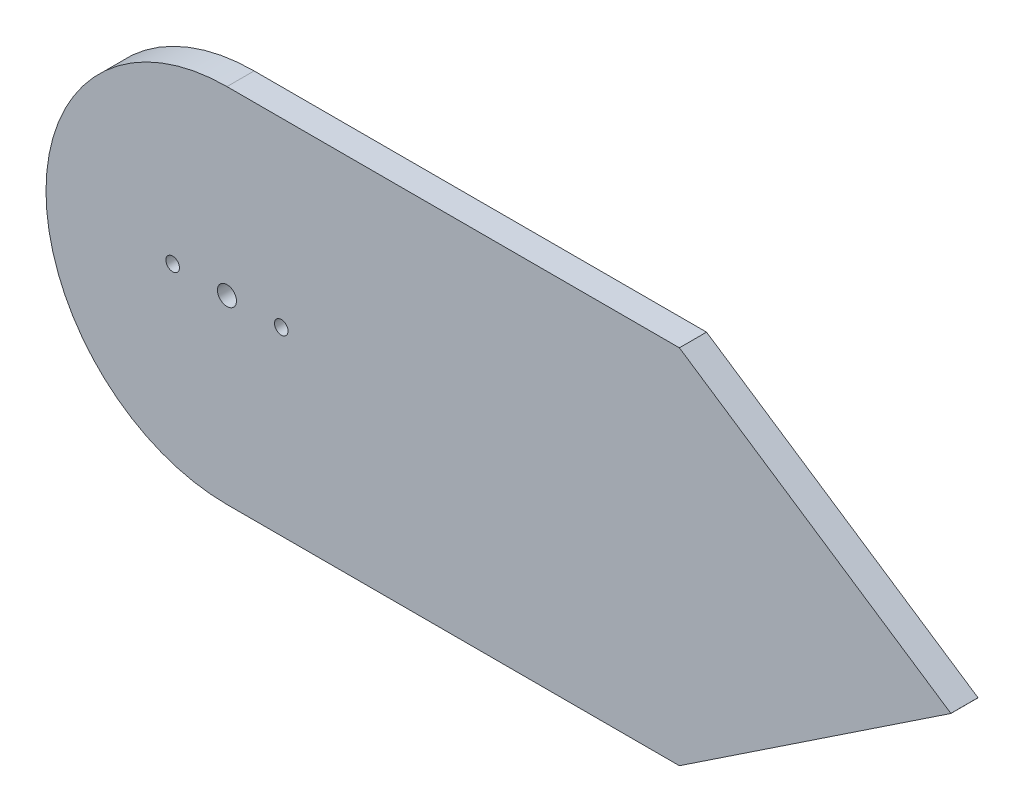
from build123d import *

# Parameters (mm, degrees)
BOSS_EXTRUDE1_DEPTH   = 3
BODY_MOVE_COPY1_ANGLE = 90
CUT_EXTRUDE2_REACH    = 84.517
SKETCH8_R             = 1.05
SKETCH8_R_2           = 0.75


with BuildPart() as part:
    # Sketch1 → Boss-Extrude1 (new body)
    with BuildSketch(Plane(origin=(0, 0, 0), x_dir=(1, 0, 0), z_dir=(0, 1, 0))):
        with BuildLine():
            Line((50, -20), (0, -20))
            ThreePointArc((0, -20), (-20, 0), (0, 20))
            Line((0, 20), (50, 20))
            Line((50, 20), (80, 0.010830805))
            Line((80, 0.010830805), (80, 0))
            Line((80, 0), (50, -20))
        make_face()
    extrude(amount=BOSS_EXTRUDE1_DEPTH)


with BuildPart() as part_1:
    # Body-Move/Copy1: moved
    add(part.part.rotate(Axis((0, 0, 0), (1, 0, 0)), BODY_MOVE_COPY1_ANGLE))

    # Sketch8 → Cut-Extrude2 (cut, up to next)
    with BuildSketch(Plane.XY.offset(3), mode=Mode.PRIVATE) as cut_extrude2_sk1:
        Circle(SKETCH8_R)
    cut_extrude2_tool1 = extrude(cut_extrude2_sk1.sketch, amount=-CUT_EXTRUDE2_REACH, mode=Mode.PRIVATE) & part_1.part
    # Sketch8 → Cut-Extrude2 (cut, up to next)
    with BuildSketch(Plane.XY.offset(3), mode=Mode.PRIVATE) as cut_extrude2_sk2:
        with Locations((6, -0.032589943)):
            Circle(SKETCH8_R_2)
    cut_extrude2_tool2 = extrude(cut_extrude2_sk2.sketch, amount=-CUT_EXTRUDE2_REACH, mode=Mode.PRIVATE) & part_1.part
    # Sketch8 → Cut-Extrude2 (cut, up to next)
    with BuildSketch(Plane.XY.offset(3), mode=Mode.PRIVATE) as cut_extrude2_sk3:
        with Locations((-5.999934973, 0.027934237)):
            Circle(SKETCH8_R_2)
    cut_extrude2_tool3 = extrude(cut_extrude2_sk3.sketch, amount=-CUT_EXTRUDE2_REACH, mode=Mode.PRIVATE) & part_1.part
    add(cut_extrude2_tool1.solids().sort_by_distance((0, 0, 3))[0], mode=Mode.SUBTRACT)
    add(cut_extrude2_tool2.solids().sort_by_distance((6, -0.03259, 3))[0], mode=Mode.SUBTRACT)
    add(cut_extrude2_tool3.solids().sort_by_distance((-5.999935, 0.027934, 3))[0], mode=Mode.SUBTRACT)


with BuildPart() as part_2:
    # Body-Move/Copy4: moved
    add(part_1.part.moved(Location((0, 0, -3))))


solid = part_2.part
